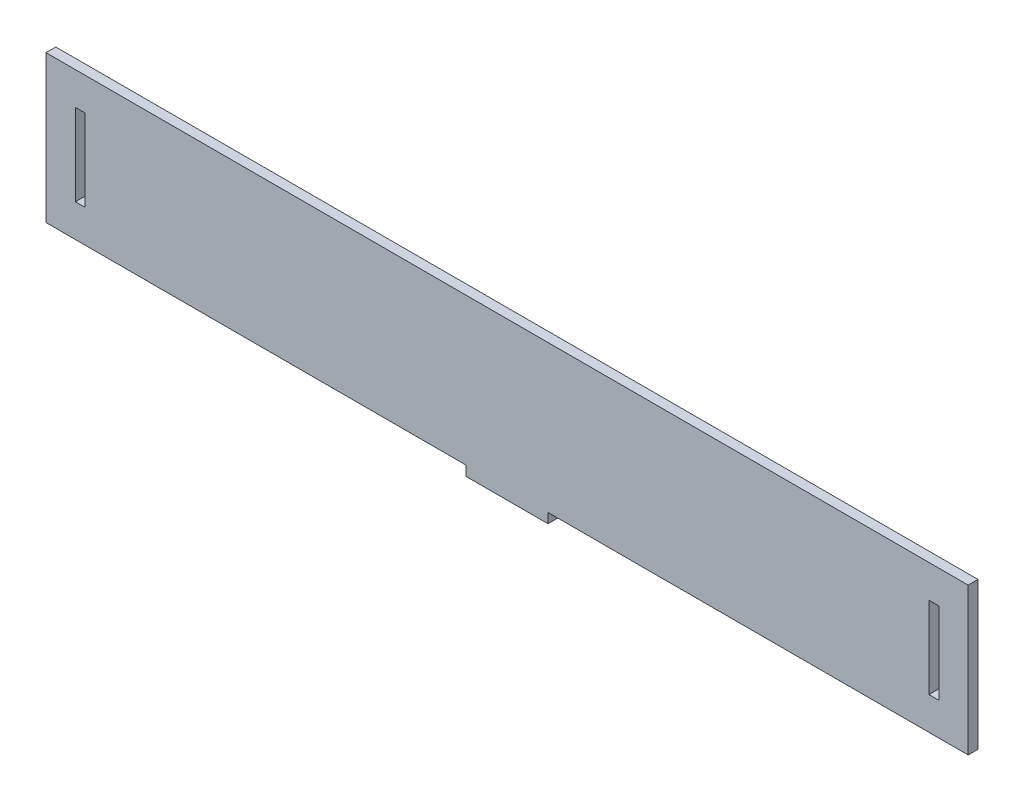
from build123d import *

# Parameters (mm, degrees)
SKETCH1_W           = 6
SKETCH1_H           = 50
BOSS_EXTRUDE1_DEPTH = 6


with BuildPart() as part:
    # Sketch1 → Boss-Extrude1 (new body)
    with BuildSketch(Plane.XY):
        Polygon((0, 0), (564, 0), (564, -90), (307, -90), (307, -96), (257, -96), (257, -90), (0, -90), align=None)
        with Locations((543, -45)):
            Rectangle(SKETCH1_W, SKETCH1_H, mode=Mode.SUBTRACT)
        with Locations((21, -45)):
            Rectangle(SKETCH1_W, SKETCH1_H, mode=Mode.SUBTRACT)
    extrude(amount=BOSS_EXTRUDE1_DEPTH)


solid = part.part
